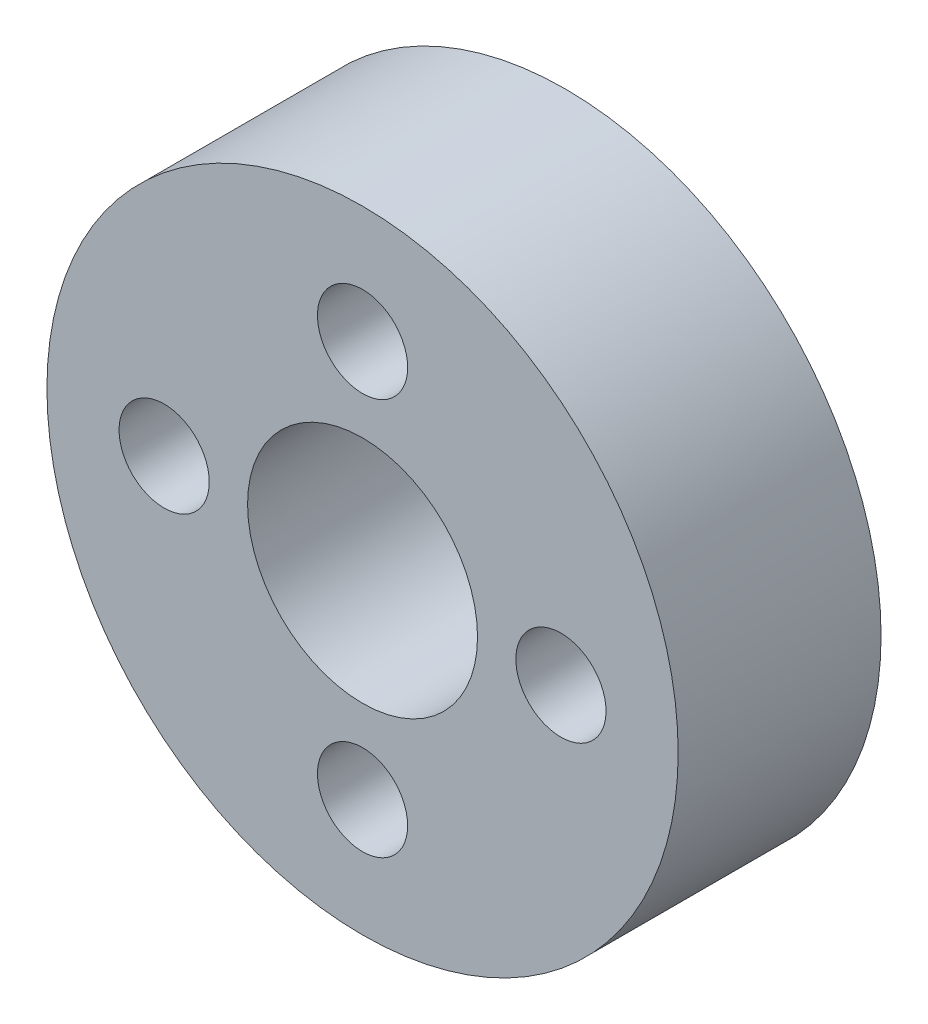
from build123d import *
from build123d.topology import SkipClean

# Parameters (mm, degrees)
SKETCH1_R           = 17.78
SKETCH1_R_2         = 2.54
SKETCH1_R_3         = 6.477
BOSS_EXTRUDE1_DEPTH = 11.43
BOSS_EXTRUDE2_START = 3.175
SKETCH2_W           = 16.51
SKETCH2_H           = 16.51
SKETCH2_R           = 6.477
BOSS_EXTRUDE2_DEPTH = 3.175


with BuildPart() as part:
    # Sketch1 → Boss-Extrude1 (new body)
    with BuildSketch(Plane.XY):
        Circle(SKETCH1_R)
        with Locations((-11.176, 0)):
            Circle(SKETCH1_R_2, mode=Mode.SUBTRACT)
        with Locations((0, -11.176)):
            Circle(SKETCH1_R_2, mode=Mode.SUBTRACT)
        with Locations((11.176, 0)):
            Circle(SKETCH1_R_2, mode=Mode.SUBTRACT)
        with Locations((0, 11.176)):
            Circle(SKETCH1_R_2, mode=Mode.SUBTRACT)
        Circle(SKETCH1_R_3, mode=Mode.SUBTRACT)
    extrude(amount=BOSS_EXTRUDE1_DEPTH)

    # Sketch2 → Boss-Extrude2 (add)
    with SkipClean():  # the faces are left unmerged after this step: merging them gives an invalid solid
        with BuildSketch(Plane(origin=(0, 0, 0), x_dir=(-1, 0, 0), z_dir=(0, 0, -1)).offset(BOSS_EXTRUDE2_START)):
            Rectangle(SKETCH2_W, SKETCH2_H)
            Circle(SKETCH2_R, mode=Mode.SUBTRACT)
        extrude(amount=-BOSS_EXTRUDE2_DEPTH)


solid = part.part
